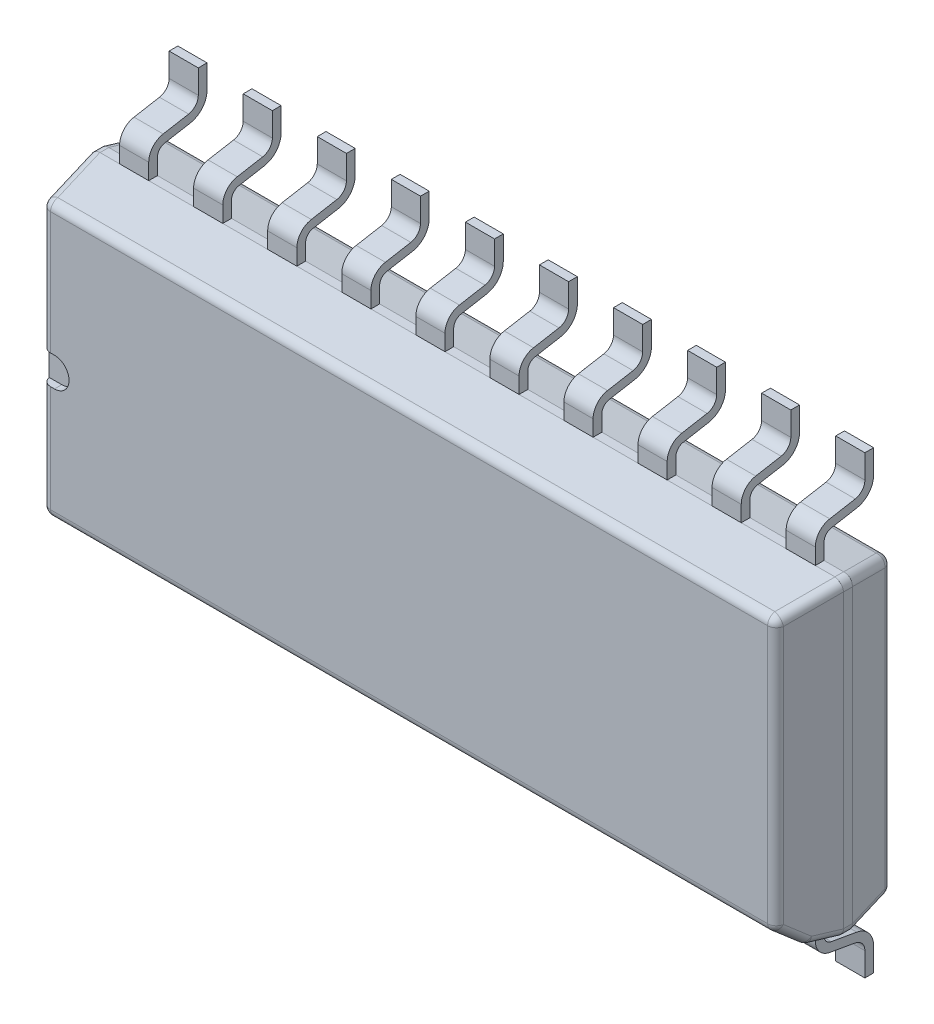
from build123d import *
from OCP.BRepFilletAPI import BRepFilletAPI_MakeChamfer

# Parameters (mm, degrees)
SKETCH1_W              = 0.5
SKETCH1_H              = 1.25
BOSS_EXTRUDE1_DEPTH    = 1
BOSS_EXTRUDE1_2_DEPTH  = 1
BOSS_EXTRUDE1_3_DEPTH  = 1
BOSS_EXTRUDE1_4_DEPTH  = 1
BOSS_EXTRUDE1_5_DEPTH  = 1
BOSS_EXTRUDE1_6_DEPTH  = 1
BOSS_EXTRUDE1_7_DEPTH  = 1
BOSS_EXTRUDE1_8_DEPTH  = 1
BOSS_EXTRUDE1_9_DEPTH  = 1
BOSS_EXTRUDE1_10_DEPTH = 1
BOSS_EXTRUDE1_11_DEPTH = 1
BOSS_EXTRUDE1_12_DEPTH = 1
BOSS_EXTRUDE1_13_DEPTH = 1
BOSS_EXTRUDE1_14_DEPTH = 1
BOSS_EXTRUDE1_15_DEPTH = 1
BOSS_EXTRUDE1_16_DEPTH = 1
BOSS_EXTRUDE1_17_DEPTH = 1
BOSS_EXTRUDE1_18_DEPTH = 1
BOSS_EXTRUDE1_19_DEPTH = 1
BOSS_EXTRUDE1_20_DEPTH = 1
CUT_EXTRUDE1_DEPTH     = 13.591064292
SKETCH3_W              = 12.9
SKETCH3_H              = 5.3
BOSS_EXTRUDE2_DEPTH    = 1.95
CHAMFER1_SIZE          = 1
CHAMFER1_SIZE2         = 0.176326981
CHAMFER2_SIZE          = 0.8
CHAMFER2_SIZE2         = 0.141061585
CHAMFER3_SIZE          = 0.5
CHAMFER3_SIZE2         = 0.326351822
FILLET1_R              = 0.15
CUT_EXTRUDE2_DEPTH     = 0.125


with BuildPart() as part:
    # Sketch1 → Boss-Extrude1 (new body)
    with BuildSketch(Plane.XY):
        with Locations((-4.445, -3.275)):
            Rectangle(SKETCH1_W, SKETCH1_H)
    extrude(amount=BOSS_EXTRUDE1_DEPTH)


with BuildPart() as body_2:
    # Sketch1 → Boss-Extrude1 2 (new body)
    with BuildSketch(Plane.XY):
        with Locations((-5.715, -3.275)):
            Rectangle(SKETCH1_W, SKETCH1_H)
    extrude(amount=BOSS_EXTRUDE1_2_DEPTH)


with BuildPart() as body_3:
    # Sketch1 → Boss-Extrude1 3 (new body)
    with BuildSketch(Plane.XY):
        with Locations((-3.175, -3.275)):
            Rectangle(SKETCH1_W, SKETCH1_H)
    extrude(amount=BOSS_EXTRUDE1_3_DEPTH)


with BuildPart() as body_4:
    # Sketch1 → Boss-Extrude1 4 (new body)
    with BuildSketch(Plane.XY):
        with Locations((-1.905, -3.275)):
            Rectangle(SKETCH1_W, SKETCH1_H)
    extrude(amount=BOSS_EXTRUDE1_4_DEPTH)


with BuildPart() as body_5:
    # Sketch1 → Boss-Extrude1 5 (new body)
    with BuildSketch(Plane.XY):
        with Locations((-0.635, -3.275)):
            Rectangle(SKETCH1_W, SKETCH1_H)
    extrude(amount=BOSS_EXTRUDE1_5_DEPTH)


with BuildPart() as body_6:
    # Sketch1 → Boss-Extrude1 6 (new body)
    with BuildSketch(Plane.XY):
        with Locations((0.635, -3.275)):
            Rectangle(SKETCH1_W, SKETCH1_H)
    extrude(amount=BOSS_EXTRUDE1_6_DEPTH)


with BuildPart() as body_7:
    # Sketch1 → Boss-Extrude1 7 (new body)
    with BuildSketch(Plane.XY):
        with Locations((1.905, -3.275)):
            Rectangle(SKETCH1_W, SKETCH1_H)
    extrude(amount=BOSS_EXTRUDE1_7_DEPTH)


with BuildPart() as body_8:
    # Sketch1 → Boss-Extrude1 8 (new body)
    with BuildSketch(Plane.XY):
        with Locations((3.175, -3.275)):
            Rectangle(SKETCH1_W, SKETCH1_H)
    extrude(amount=BOSS_EXTRUDE1_8_DEPTH)


with BuildPart() as body_9:
    # Sketch1 → Boss-Extrude1 9 (new body)
    with BuildSketch(Plane.XY):
        with Locations((4.445, -3.275)):
            Rectangle(SKETCH1_W, SKETCH1_H)
    extrude(amount=BOSS_EXTRUDE1_9_DEPTH)


with BuildPart() as body_10:
    # Sketch1 → Boss-Extrude1 10 (new body)
    with BuildSketch(Plane.XY):
        with Locations((5.715, -3.275)):
            Rectangle(SKETCH1_W, SKETCH1_H)
    extrude(amount=BOSS_EXTRUDE1_10_DEPTH)


with BuildPart() as body_11:
    # Sketch1 → Boss-Extrude1 11 (new body)
    with BuildSketch(Plane.XY):
        with Locations((5.715, 3.275)):
            Rectangle(SKETCH1_W, SKETCH1_H)
    extrude(amount=BOSS_EXTRUDE1_11_DEPTH)


with BuildPart() as body_12:
    # Sketch1 → Boss-Extrude1 12 (new body)
    with BuildSketch(Plane.XY):
        with Locations((4.445, 3.275)):
            Rectangle(SKETCH1_W, SKETCH1_H)
    extrude(amount=BOSS_EXTRUDE1_12_DEPTH)


with BuildPart() as body_13:
    # Sketch1 → Boss-Extrude1 13 (new body)
    with BuildSketch(Plane.XY):
        with Locations((3.175, 3.275)):
            Rectangle(SKETCH1_W, SKETCH1_H)
    extrude(amount=BOSS_EXTRUDE1_13_DEPTH)


with BuildPart() as body_14:
    # Sketch1 → Boss-Extrude1 14 (new body)
    with BuildSketch(Plane.XY):
        with Locations((1.905, 3.275)):
            Rectangle(SKETCH1_W, SKETCH1_H)
    extrude(amount=BOSS_EXTRUDE1_14_DEPTH)


with BuildPart() as body_15:
    # Sketch1 → Boss-Extrude1 15 (new body)
    with BuildSketch(Plane.XY):
        with Locations((0.635, 3.275)):
            Rectangle(SKETCH1_W, SKETCH1_H)
    extrude(amount=BOSS_EXTRUDE1_15_DEPTH)


with BuildPart() as body_16:
    # Sketch1 → Boss-Extrude1 16 (new body)
    with BuildSketch(Plane.XY):
        with Locations((-0.635, 3.275)):
            Rectangle(SKETCH1_W, SKETCH1_H)
    extrude(amount=BOSS_EXTRUDE1_16_DEPTH)


with BuildPart() as body_17:
    # Sketch1 → Boss-Extrude1 17 (new body)
    with BuildSketch(Plane.XY):
        with Locations((-1.905, 3.275)):
            Rectangle(SKETCH1_W, SKETCH1_H)
    extrude(amount=BOSS_EXTRUDE1_17_DEPTH)


with BuildPart() as body_18:
    # Sketch1 → Boss-Extrude1 18 (new body)
    with BuildSketch(Plane.XY):
        with Locations((-3.175, 3.275)):
            Rectangle(SKETCH1_W, SKETCH1_H)
    extrude(amount=BOSS_EXTRUDE1_18_DEPTH)


with BuildPart() as body_19:
    # Sketch1 → Boss-Extrude1 19 (new body)
    with BuildSketch(Plane.XY):
        with Locations((-4.445, 3.275)):
            Rectangle(SKETCH1_W, SKETCH1_H)
    extrude(amount=BOSS_EXTRUDE1_19_DEPTH)


with BuildPart() as body_20:
    # Sketch1 → Boss-Extrude1 20 (new body)
    with BuildSketch(Plane.XY):
        with Locations((-5.715, 3.275)):
            Rectangle(SKETCH1_W, SKETCH1_H)
    extrude(amount=BOSS_EXTRUDE1_20_DEPTH)


with BuildPart() as cut_extrude1_tool:
    # Sketch2 → Cut-Extrude1 (new, through all)
    with BuildSketch(Plane.ZY.offset(5.965)):
        with BuildLine():
            Line((0, 3.493684871), (0, 2.65))
            Line((0, 2.65), (0.85, 2.65))
            Line((0.85, 2.65), (0.85, 2.924257122))
            ThreePointArc((0.85, 2.924257122), (0.814906666, 3.020675263), (0.726047227, 3.071978285))
            Line((0.726047227, 3.071978285), (0.289223138, 3.149002157))
            ThreePointArc((0.289223138, 3.149002157), (0.081884445, 3.268709208), (0, 3.493684871))
        make_face()
        with BuildLine():
            Line((0.15, 3.9), (0.15, 3.493684871))
            ThreePointArc((0.15, 3.493684871), (0.196791111, 3.365127349), (0.315270364, 3.29672332))
            Line((0.315270364, 3.29672332), (0.752094453, 3.219699448))
            ThreePointArc((0.752094453, 3.219699448), (0.929813333, 3.117093405), (1, 2.924257122))
            Line((1, 2.924257122), (1, 3.9))
            Line((1, 3.9), (0.15, 3.9))
        make_face()
        with BuildLine():
            Line((1, -3.9), (1, -2.924257122))
            ThreePointArc((1, -2.924257122), (0.929813333, -3.117093405), (0.752094453, -3.219699448))
            Line((0.752094453, -3.219699448), (0.315270364, -3.29672332))
            ThreePointArc((0.315270364, -3.29672332), (0.196791111, -3.365127349), (0.15, -3.493684871))
            Line((0.15, -3.493684871), (0.15, -3.9))
            Line((0.15, -3.9), (1, -3.9))
        make_face()
        with BuildLine():
            Line((0, -2.65), (0.85, -2.65))
            Line((0.85, -2.65), (0.85, -2.924257122))
            ThreePointArc((0.85, -2.924257122), (0.814906666, -3.020675263), (0.726047227, -3.071978285))
            Line((0.726047227, -3.071978285), (0.289223138, -3.149002157))
            ThreePointArc((0.289223138, -3.149002157), (0.081884445, -3.268709208), (0, -3.493684871))
            Line((0, -3.493684871), (0, -2.65))
        make_face()
    extrude(amount=-CUT_EXTRUDE1_DEPTH)


with BuildPart() as part_1:
    add(part.part)

    # Cut-Extrude1: cut by cut_extrude1_tool
    add(cut_extrude1_tool.part, mode=Mode.SUBTRACT)


with BuildPart() as body_2_1:
    add(body_2.part)

    # Cut-Extrude1: cut by cut_extrude1_tool
    add(cut_extrude1_tool.part, mode=Mode.SUBTRACT)


with BuildPart() as body_3_1:
    add(body_3.part)

    # Cut-Extrude1: cut by cut_extrude1_tool
    add(cut_extrude1_tool.part, mode=Mode.SUBTRACT)


with BuildPart() as body_4_1:
    add(body_4.part)

    # Cut-Extrude1: cut by cut_extrude1_tool
    add(cut_extrude1_tool.part, mode=Mode.SUBTRACT)


with BuildPart() as body_5_1:
    add(body_5.part)

    # Cut-Extrude1: cut by cut_extrude1_tool
    add(cut_extrude1_tool.part, mode=Mode.SUBTRACT)


with BuildPart() as body_6_1:
    add(body_6.part)

    # Cut-Extrude1: cut by cut_extrude1_tool
    add(cut_extrude1_tool.part, mode=Mode.SUBTRACT)


with BuildPart() as body_7_1:
    add(body_7.part)

    # Cut-Extrude1: cut by cut_extrude1_tool
    add(cut_extrude1_tool.part, mode=Mode.SUBTRACT)


with BuildPart() as body_8_1:
    add(body_8.part)

    # Cut-Extrude1: cut by cut_extrude1_tool
    add(cut_extrude1_tool.part, mode=Mode.SUBTRACT)


with BuildPart() as body_9_1:
    add(body_9.part)

    # Cut-Extrude1: cut by cut_extrude1_tool
    add(cut_extrude1_tool.part, mode=Mode.SUBTRACT)


with BuildPart() as body_10_1:
    add(body_10.part)

    # Cut-Extrude1: cut by cut_extrude1_tool
    add(cut_extrude1_tool.part, mode=Mode.SUBTRACT)


with BuildPart() as body_11_1:
    add(body_11.part)

    # Cut-Extrude1: cut by cut_extrude1_tool
    add(cut_extrude1_tool.part, mode=Mode.SUBTRACT)


with BuildPart() as body_12_1:
    add(body_12.part)

    # Cut-Extrude1: cut by cut_extrude1_tool
    add(cut_extrude1_tool.part, mode=Mode.SUBTRACT)


with BuildPart() as body_13_1:
    add(body_13.part)

    # Cut-Extrude1: cut by cut_extrude1_tool
    add(cut_extrude1_tool.part, mode=Mode.SUBTRACT)


with BuildPart() as body_14_1:
    add(body_14.part)

    # Cut-Extrude1: cut by cut_extrude1_tool
    add(cut_extrude1_tool.part, mode=Mode.SUBTRACT)


with BuildPart() as body_15_1:
    add(body_15.part)

    # Cut-Extrude1: cut by cut_extrude1_tool
    add(cut_extrude1_tool.part, mode=Mode.SUBTRACT)


with BuildPart() as body_16_1:
    add(body_16.part)

    # Cut-Extrude1: cut by cut_extrude1_tool
    add(cut_extrude1_tool.part, mode=Mode.SUBTRACT)


with BuildPart() as body_17_1:
    add(body_17.part)

    # Cut-Extrude1: cut by cut_extrude1_tool
    add(cut_extrude1_tool.part, mode=Mode.SUBTRACT)


with BuildPart() as body_18_1:
    add(body_18.part)

    # Cut-Extrude1: cut by cut_extrude1_tool
    add(cut_extrude1_tool.part, mode=Mode.SUBTRACT)


with BuildPart() as body_19_1:
    add(body_19.part)

    # Cut-Extrude1: cut by cut_extrude1_tool
    add(cut_extrude1_tool.part, mode=Mode.SUBTRACT)


with BuildPart() as body_20_1:
    add(body_20.part)

    # Cut-Extrude1: cut by cut_extrude1_tool
    add(cut_extrude1_tool.part, mode=Mode.SUBTRACT)


with BuildPart() as body_21:
    # Sketch3 → Boss-Extrude2 (new body)
    with BuildSketch(Plane.XY.offset(0.05)):
        Rectangle(SKETCH3_W, SKETCH3_H)
    extrude(amount=BOSS_EXTRUDE2_DEPTH)

    # Chamfer1: one chamfer whose edges measure the first distance from different faces: ONE call of the kernel's chamfer builder (chamfer() names one face for all edges)
    chamfer1_edges_1 = [body_21.edges().sort_by_distance(p)[0] for p in [
        (-6.45, 0, 2),
    ]]
    chamfer1_side_1 = [body_21.faces().sort_by_distance(p)[0] for p in [
        (-6.45, 0, 1.025),
    ]]
    chamfer1_edges_2 = [body_21.edges().sort_by_distance(p)[0] for p in [
        (0, -2.65, 2),
    ]]
    chamfer1_side_2 = [body_21.faces().sort_by_distance(p)[0] for p in [
        (0, -2.65, 1.025),
    ]]
    chamfer1_edges_3 = [body_21.edges().sort_by_distance(p)[0] for p in [
        (6.45, 0, 2),
    ]]
    chamfer1_side_3 = [body_21.faces().sort_by_distance(p)[0] for p in [
        (6.45, 0, 1.025),
    ]]
    chamfer1_edges_4 = [body_21.edges().sort_by_distance(p)[0] for p in [
        (0, 2.65, 2),
    ]]
    chamfer1_side_4 = [body_21.faces().sort_by_distance(p)[0] for p in [
        (0, 2.65, 1.025),
    ]]
    chamfer1 = BRepFilletAPI_MakeChamfer(body_21.part.solid().wrapped)
    for e in chamfer1_edges_1:
        chamfer1.Add(CHAMFER1_SIZE, CHAMFER1_SIZE2, e.wrapped, chamfer1_side_1[0].wrapped)  # the first distance lies on this face
    for e in chamfer1_edges_2:
        chamfer1.Add(CHAMFER1_SIZE, CHAMFER1_SIZE2, e.wrapped, chamfer1_side_2[0].wrapped)  # the first distance lies on this face
    for e in chamfer1_edges_3:
        chamfer1.Add(CHAMFER1_SIZE, CHAMFER1_SIZE2, e.wrapped, chamfer1_side_3[0].wrapped)  # the first distance lies on this face
    for e in chamfer1_edges_4:
        chamfer1.Add(CHAMFER1_SIZE, CHAMFER1_SIZE2, e.wrapped, chamfer1_side_4[0].wrapped)  # the first distance lies on this face
    add(Compound.cast(chamfer1.Shape()), mode=Mode.REPLACE)

    # Chamfer2: one chamfer whose edges measure the first distance from different faces: ONE call of the kernel's chamfer builder (chamfer() names one face for all edges)
    chamfer2_edges_1 = [body_21.edges().sort_by_distance(p)[0] for p in [
        (0, -2.65, 0.05),
    ]]
    chamfer2_side_1 = [body_21.faces().sort_by_distance(p)[0] for p in [
        (0, -2.65, 0.525),
    ]]
    chamfer2_edges_2 = [body_21.edges().sort_by_distance(p)[0] for p in [
        (-6.45, 0, 0.05),
    ]]
    chamfer2_side_2 = [body_21.faces().sort_by_distance(p)[0] for p in [
        (-6.45, 0, 0.525),
    ]]
    chamfer2_edges_3 = [body_21.edges().sort_by_distance(p)[0] for p in [
        (0, 2.65, 0.05),
    ]]
    chamfer2_side_3 = [body_21.faces().sort_by_distance(p)[0] for p in [
        (0, 2.65, 0.525),
    ]]
    chamfer2_edges_4 = [body_21.edges().sort_by_distance(p)[0] for p in [
        (6.45, 0, 0.05),
    ]]
    chamfer2_side_4 = [body_21.faces().sort_by_distance(p)[0] for p in [
        (6.45, 0, 0.525),
    ]]
    chamfer2 = BRepFilletAPI_MakeChamfer(body_21.part.solid().wrapped)
    for e in chamfer2_edges_1:
        chamfer2.Add(CHAMFER2_SIZE, CHAMFER2_SIZE2, e.wrapped, chamfer2_side_1[0].wrapped)  # the first distance lies on this face
    for e in chamfer2_edges_2:
        chamfer2.Add(CHAMFER2_SIZE, CHAMFER2_SIZE2, e.wrapped, chamfer2_side_2[0].wrapped)  # the first distance lies on this face
    for e in chamfer2_edges_3:
        chamfer2.Add(CHAMFER2_SIZE, CHAMFER2_SIZE2, e.wrapped, chamfer2_side_3[0].wrapped)  # the first distance lies on this face
    for e in chamfer2_edges_4:
        chamfer2.Add(CHAMFER2_SIZE, CHAMFER2_SIZE2, e.wrapped, chamfer2_side_4[0].wrapped)  # the first distance lies on this face
    add(Compound.cast(chamfer2.Shape()), mode=Mode.REPLACE)

    # Chamfer3
    chamfer3_edges = [body_21.edges().sort_by_distance(p)[0] for p in [
        (0, -2.473673019, 2),
    ]]
    chamfer3_side = [body_21.faces().sort_by_distance(p)[0] for p in [
        (0, -2.562243772, 1.497690303),
    ]]
    chamfer(chamfer3_edges, length=CHAMFER3_SIZE, length2=CHAMFER3_SIZE2, reference=chamfer3_side[0])

    # Fillet1
    fillet1_edges = [body_21.edges().sort_by_distance(p)[0] for p in [
        (0, 2.473673019, 2),
        (-6.273673019, 0.163175911, 2),
        (6.45, 2.65, 0.925),
        (6.45, -2.65, 0.925),
        (-6.45, -2.65, 0.925),
        (-6.45, 2.65, 0.925),
        (-6.36183651, 2.56183651, 1.5),
        (6.36183651, 2.56183651, 1.5),
        (0, 2.508938415, 0.05),
        (6.308938415, 0, 0.05),
        (0, -2.508938415, 0.05),
        (-6.308938415, 0, 0.05),
        (6.379469208, 2.579469208, 0.45),
        (6.379469208, -2.579469208, 0.45),
        (-6.379469208, 2.579469208, 0.45),
        (-6.379469208, -2.579469208, 0.45),
        (6.273673019, 0.163175911, 2),
        (0, -2.147321197, 2),
        (6.405248554, -2.605248554, 1.253798062),
        (6.317085064, -2.353909153, 1.753798062),
        (-6.405248554, -2.605248554, 1.253798062),
        (0, -2.560497108, 1.507596123),
        (-6.317085064, -2.353909153, 1.753798062),
    ]]
    fillet(fillet1_edges, radius=FILLET1_R)

    # Sketch4 → Cut-Extrude2 (cut)
    with BuildSketch(Plane.XY.offset(2)):
        with BuildLine():
            Line((-6.45, 0.25), (-6.080794634, 0.25))
            ThreePointArc((-6.080794634, 0.25), (-5.830794634, 0), (-6.080794634, -0.25))
            Line((-6.080794634, -0.25), (-6.45, -0.25))
            Line((-6.45, -0.25), (-6.45, 0.25))
        make_face()
    extrude(amount=-CUT_EXTRUDE2_DEPTH, mode=Mode.SUBTRACT)


solid = Compound([part_1.part, body_2_1.part, body_3_1.part, body_4_1.part, body_5_1.part, body_6_1.part, body_7_1.part, body_8_1.part, body_9_1.part, body_10_1.part, body_11_1.part, body_12_1.part, body_13_1.part, body_14_1.part, body_15_1.part, body_16_1.part, body_17_1.part, body_18_1.part, body_19_1.part, body_20_1.part, body_21.part])
